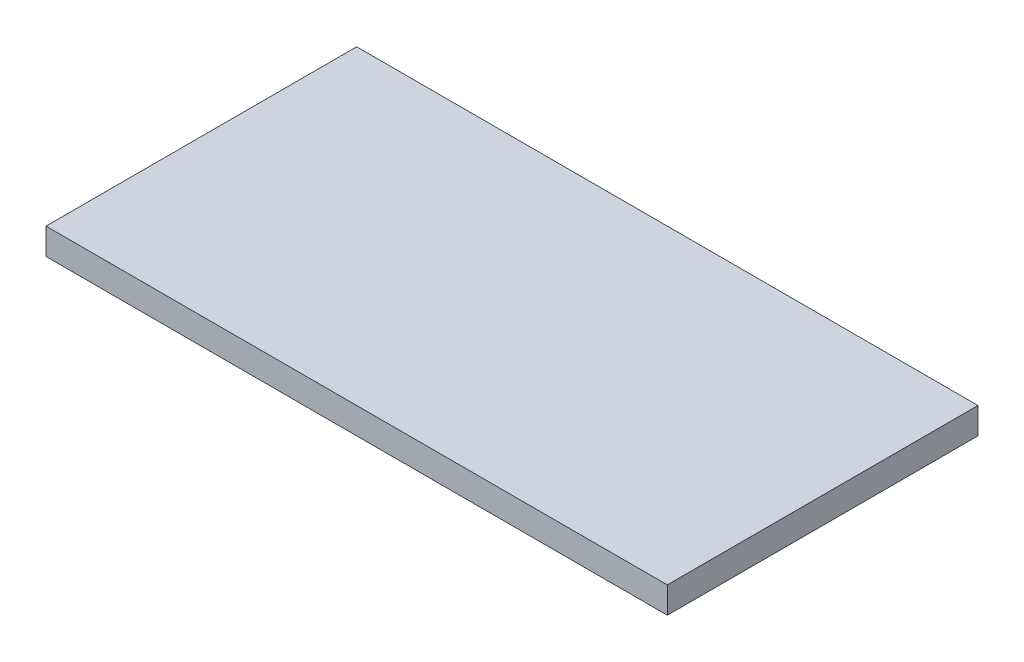
from build123d import *

# Parameters (mm, degrees)
SKETCH1_W           = 600
SKETCH1_H           = 300
BOSS_EXTRUDE1_DEPTH = 25.4


with BuildPart() as part:
    # Sketch1 → Boss-Extrude1 (new body)
    with BuildSketch(Plane(origin=(0, 0, 0), x_dir=(1, 0, 0), z_dir=(0, 1, 0))):
        with Locations((300, 150)):
            Rectangle(SKETCH1_W, SKETCH1_H)
    extrude(amount=BOSS_EXTRUDE1_DEPTH)


solid = part.part
